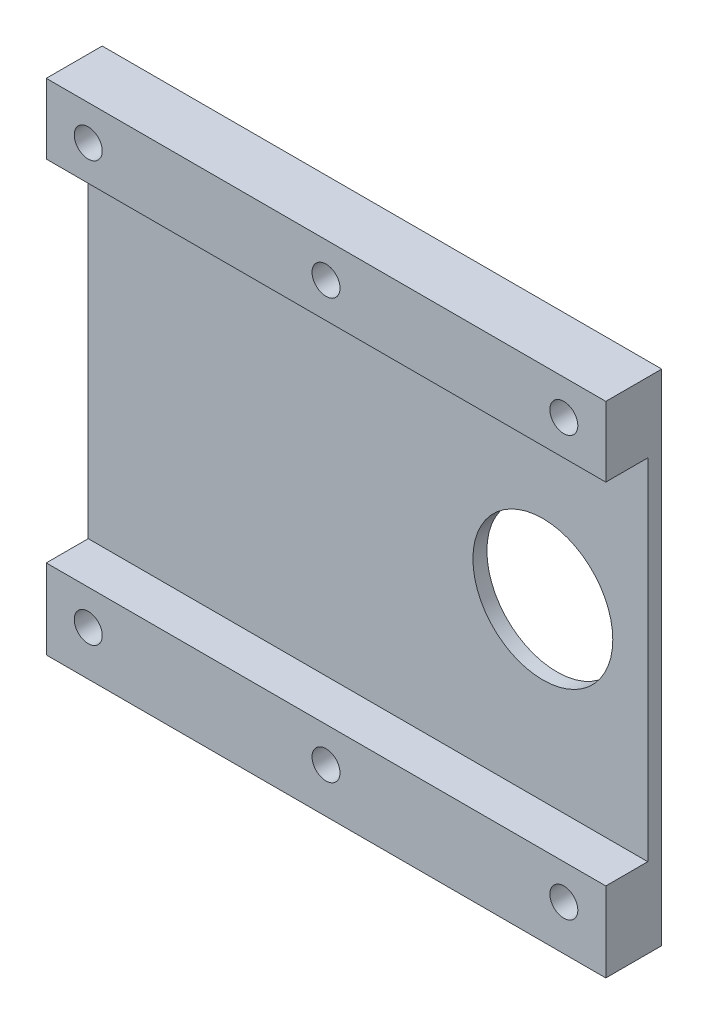
from build123d import *

# Parameters (mm, degrees)
SKETCH1_W           = 40
SKETCH1_H           = 35.7
SKETCH1_R           = 1
BOSS_EXTRUDE1_DEPTH = 4
SKETCH2_W           = 50
SKETCH2_H           = 25
CUT_EXTRUDE1_DEPTH  = 3
SKETCH3_R           = 1
CUT_EXTRUDE2_DEPTH  = 3
SKETCH4_R           = 5
CUT_EXTRUDE3_DEPTH  = 28.103920381


with BuildPart() as part:
    # Sketch1 → Boss-Extrude1 (new body)
    with BuildSketch(Plane.XY):
        Rectangle(SKETCH1_W, SKETCH1_H)
        with Locations((-17, 15.35)):
            Circle(SKETCH1_R, mode=Mode.SUBTRACT)
        with Locations((0, 15.35)):
            Circle(SKETCH1_R, mode=Mode.SUBTRACT)
        with Locations((17, 15.35)):
            Circle(SKETCH1_R, mode=Mode.SUBTRACT)
        with Locations((-17, -14.65)):
            Circle(SKETCH1_R, mode=Mode.SUBTRACT)
        with Locations((0, -14.65)):
            Circle(SKETCH1_R, mode=Mode.SUBTRACT)
        with Locations((17, -14.65)):
            Circle(SKETCH1_R, mode=Mode.SUBTRACT)
    extrude(amount=BOSS_EXTRUDE1_DEPTH)

    # Sketch2 → Cut-Extrude1 (cut)
    with BuildSketch(Plane.XY.offset(4)):
        with Locations((0, 0.35)):
            Rectangle(SKETCH2_W, SKETCH2_H)
    extrude(amount=-CUT_EXTRUDE1_DEPTH, mode=Mode.SUBTRACT)

    # Sketch3 → Cut-Extrude2 (cut)
    with BuildSketch(Plane.XZ.offset(17.85)):
        with Locations((-7.5, 2)):
            Circle(SKETCH3_R)
        with Locations((7.5, 2)):
            Circle(SKETCH3_R)
    extrude(amount=-CUT_EXTRUDE2_DEPTH, mode=Mode.SUBTRACT)

    # Sketch4 → Cut-Extrude3 (cut, through all)
    with BuildSketch(Plane(origin=(0, 0, 0), x_dir=(-1, 0, 0), z_dir=(0, 0, -1))):
        with Locations((-12.5, 0.35)):
            Circle(SKETCH4_R)
    extrude(amount=-CUT_EXTRUDE3_DEPTH, mode=Mode.SUBTRACT)


solid = part.part
